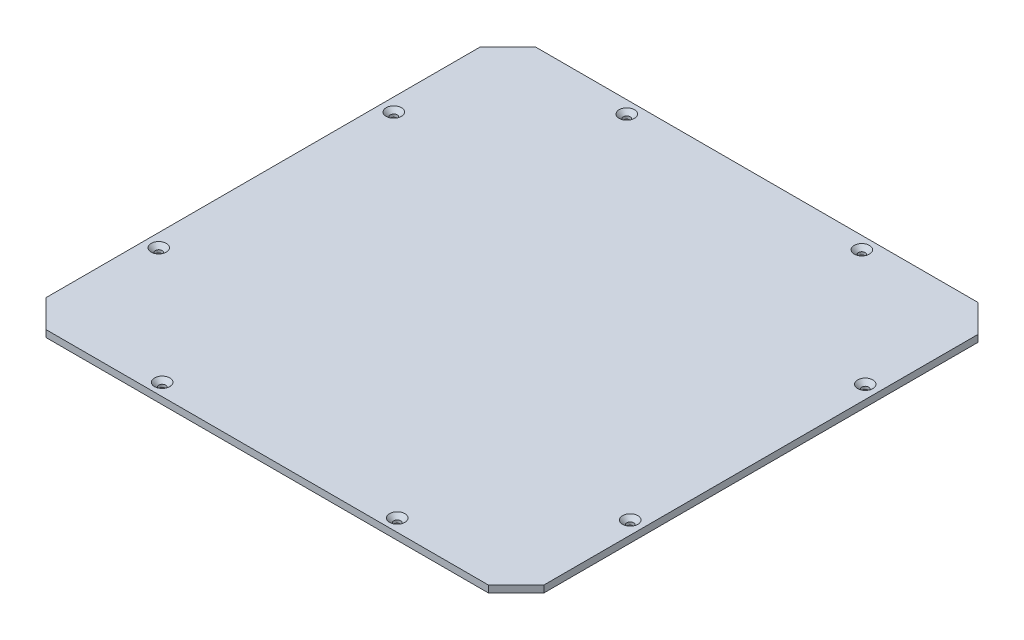
from build123d import *

# Parameters (mm, degrees)
SKETCH_1_W         = 360
SKETCH_1_H         = 354
EXTRUDE_1_DEPTH    = 5
CHAMFER_1_SIZE     = 20
SKETCH1_R          = 2.5
CUT_EXTRUDE1_DEPTH = 10
CHAMFER1_SIZE      = 3


with BuildPart() as part:
    # Эскиз1 → Бобышка-Вытянуть1 (new body)
    with BuildSketch(Plane(origin=(0, 0, 0), x_dir=(1, 0, 0), z_dir=(0, 1, 0))):
        Rectangle(SKETCH_1_W, SKETCH_1_H)
    extrude(amount=EXTRUDE_1_DEPTH)

    # Фаска1
    chamfer_1_edges = [part.edges().sort_by_distance(p)[0] for p in [
        (-180, 2.5, -177),
        (180, 2.5, -177),
        (180, 2.5, 177),
        (-180, 2.5, 177),
    ]]
    chamfer(chamfer_1_edges, length=CHAMFER_1_SIZE)

    # Sketch1 → Cut-Extrude1 (cut)
    with BuildSketch(Plane(origin=(0, 5, 0), x_dir=(1, 0, 0), z_dir=(0, 1, 0))):
        with Locations(Location((85, -168, 0), (0, 0, 90))):
            Circle(SKETCH1_R)
        with Locations(Location((-85, -168, 0), (0, 0, 90))):
            Circle(SKETCH1_R)
        with Locations(Location((-170.5, -85, 0), (0, 0, 270))):
            Circle(SKETCH1_R)
        with Locations(Location((-170.5, 85, 0), (0, 0, 270))):
            Circle(SKETCH1_R)
        with Locations(Location((-85, 168, 0), (0, 0, 270))):
            Circle(SKETCH1_R)
        with Locations(Location((85, 168, 0), (0, 0, 270))):
            Circle(SKETCH1_R)
        with Locations(Location((170.5, 85, 0), (0, 0, 90))):
            Circle(SKETCH1_R)
        with Locations(Location((170.5, -85, 0), (0, 0, 90))):
            Circle(SKETCH1_R)
    extrude(amount=-CUT_EXTRUDE1_DEPTH, mode=Mode.SUBTRACT)

    # Chamfer1
    chamfer1_edges = [part.edges().sort_by_distance(p)[0] for p in [
        (85, 5, 170.5),
        (170.5, 5, 87.5),
        (170.5, 5, -82.5),
        (85, 5, -170.5),
        (-85, 5, -170.5),
        (-170.5, 5, -87.5),
        (-170.5, 5, 82.5),
        (-85, 5, 170.5),
    ]]
    chamfer(chamfer1_edges, length=CHAMFER1_SIZE)


solid = part.part
